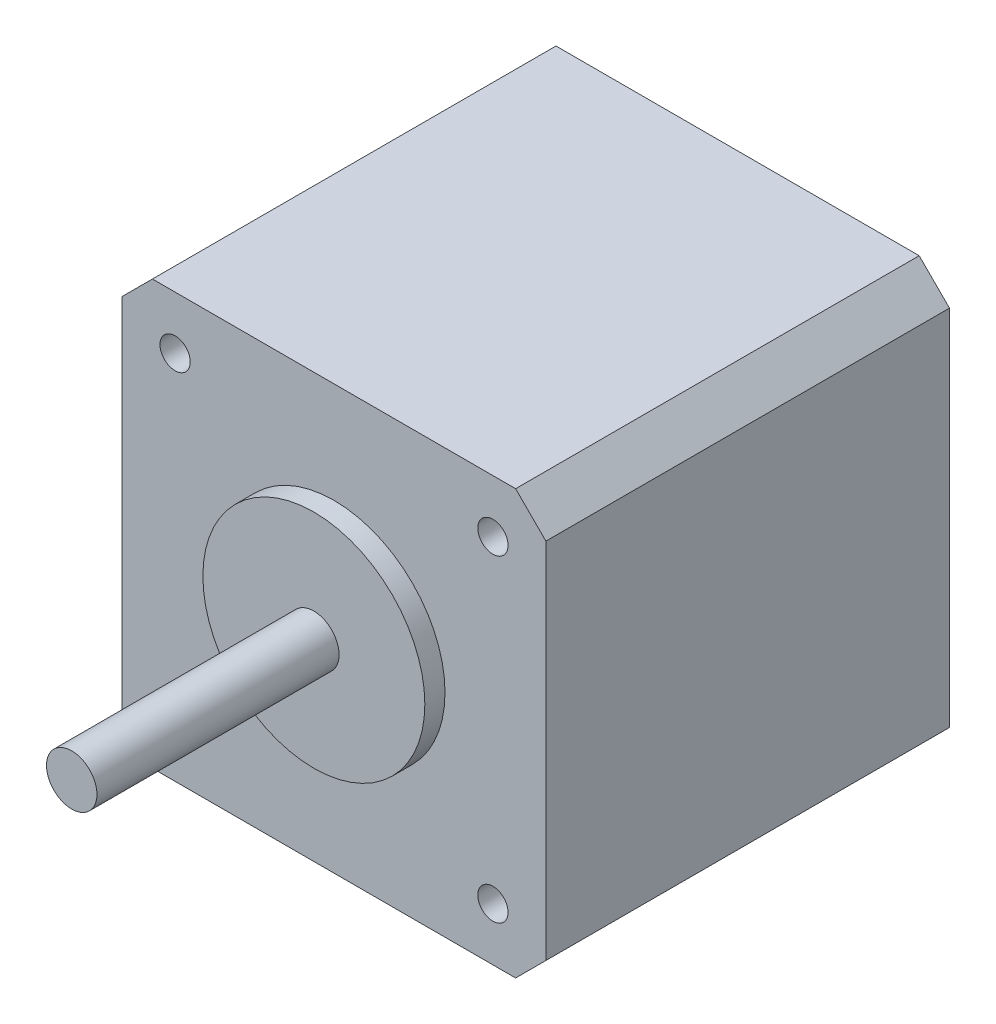
from build123d import *

# Parameters (mm, degrees)
SKETCH1_W           = 42
SKETCH1_H           = 42
BOSS_EXTRUDE1_DEPTH = 40
SKETCH2_R           = 11
BOSS_EXTRUDE2_DEPTH = 2
SKETCH3_R           = 2.5
BOSS_EXTRUDE3_DEPTH = 24
CHAMFER1_SIZE       = 3
SKETCH4_R           = 1.5
CUT_EXTRUDE1_DEPTH  = 10


with BuildPart() as part:
    # Sketch1 → Boss-Extrude1 (new body)
    with BuildSketch(Plane.XY):
        Rectangle(SKETCH1_W, SKETCH1_H)
    extrude(amount=BOSS_EXTRUDE1_DEPTH)

    # Sketch2 → Boss-Extrude2 (add)
    with BuildSketch(Plane.XY.offset(40)):
        Circle(SKETCH2_R)
    extrude(amount=BOSS_EXTRUDE2_DEPTH)

    # Sketch3 → Boss-Extrude3 (add)
    with BuildSketch(Plane.XY.offset(42)):
        Circle(SKETCH3_R)
    extrude(amount=BOSS_EXTRUDE3_DEPTH)

    # Chamfer1
    chamfer1_edges = [part.edges().sort_by_distance(p)[0] for p in [
        (21, -21, 20),
        (-21, -21, 20),
        (-21, 21, 20),
        (21, 21, 20),
    ]]
    chamfer(chamfer1_edges, length=CHAMFER1_SIZE)

    # Sketch4 → Cut-Extrude1 (cut)
    with BuildSketch(Plane.XY.offset(40)):
        with Locations((-15.75, 15.75)):
            Circle(SKETCH4_R)
        with Locations((15.75, 15.75)):
            Circle(SKETCH4_R)
        with Locations((-15.75, -15.75)):
            Circle(SKETCH4_R)
        with Locations((15.75, -15.75)):
            Circle(SKETCH4_R)
    extrude(amount=-CUT_EXTRUDE1_DEPTH, mode=Mode.SUBTRACT)


solid = part.part
